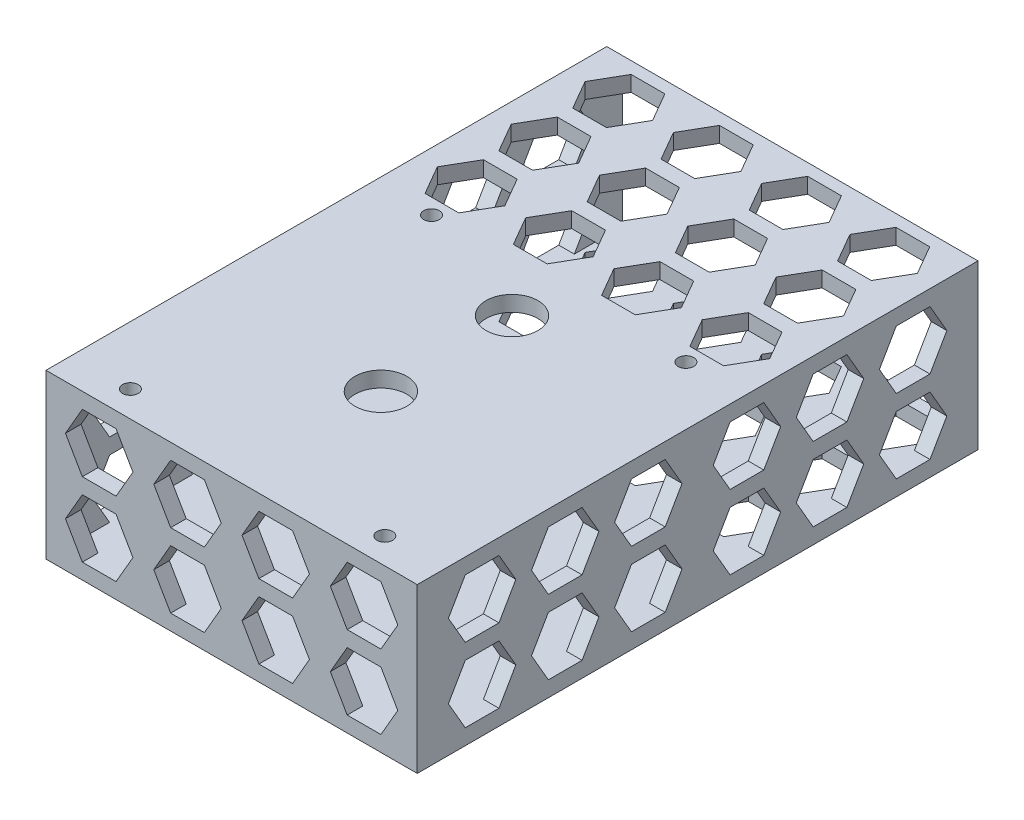
from build123d import *
from OCP.BRepFilletAPI import BRepFilletAPI_MakeChamfer

# Parameters (mm, degrees)
SKETCH5_W           = 71.5
SKETCH5_H           = 108
BOSS_EXTRUDE4_DEPTH = 31.5
SHELL1_T            = -3
SKETCH7_R           = 1.75
CUT_EXTRUDE1_DEPTH  = 73.016057237
CUT_EXTRUDE2_REACH  = 74.016
SKETCH8_R           = 5
CHAMFER1_SIZE       = 1.5
CHAMFER1_SIZE2      = 1.050311307
CUT_EXTRUDE3_REACH  = 74.016
SKETCH9_R           = 1.5
CUT_EXTRUDE4_REACH  = 120.044
CUT_EXTRUDE5_DEPTH  = 95.976312836
CUT_EXTRUDE6_DEPTH  = 73.016057237


with BuildPart() as part:
    # Sketch5 → Boss-Extrude4 (new body)
    with BuildSketch(Plane(origin=(0, 0, 0), x_dir=(1, 0, 0), z_dir=(0, 1, 0))):
        Rectangle(SKETCH5_W, SKETCH5_H)
    extrude(amount=BOSS_EXTRUDE4_DEPTH)

    # Shell1
    shell1_openings = [part.faces().sort_by_distance(p)[0] for p in [
        (0, 15.75, -54),
    ]]
    offset(amount=SHELL1_T, openings=shell1_openings, kind=Kind.INTERSECTION)

    # Sketch7 → Cut-Extrude1 (cut, through all)
    with BuildSketch(Plane(origin=(0, 31.5, 0), x_dir=(1, 0, 0), z_dir=(0, 1, 0))):
        with Locations(Location((0, 0, 0), (0, 0, 270))):
            Circle(SKETCH7_R)
        with Locations(Location((0, -25.25, 0), (0, 0, 90))):
            Circle(SKETCH7_R)
    extrude(amount=-CUT_EXTRUDE1_DEPTH, mode=Mode.SUBTRACT)

    # Sketch8 → Cut-Extrude2 (cut, up to next)
    with BuildSketch(Plane(origin=(0, 31.5, 0), x_dir=(1, 0, 0), z_dir=(0, 1, 0)), mode=Mode.PRIVATE) as cut_extrude2_sk1:
        with Locations(Location((0, -25.25, 0), (0, 0, 270))):
            Circle(SKETCH8_R)
    cut_extrude2_tool1 = extrude(cut_extrude2_sk1.sketch, amount=-CUT_EXTRUDE2_REACH, mode=Mode.PRIVATE) & part.part
    # Sketch8 → Cut-Extrude2 (cut, up to next)
    with BuildSketch(Plane(origin=(0, 31.5, 0), x_dir=(1, 0, 0), z_dir=(0, 1, 0)), mode=Mode.PRIVATE) as cut_extrude2_sk2:
        with Locations(Location((0, 0, 0), (0, 0, 270))):
            Circle(SKETCH8_R)
    cut_extrude2_tool2 = extrude(cut_extrude2_sk2.sketch, amount=-CUT_EXTRUDE2_REACH, mode=Mode.PRIVATE) & part.part
    add(cut_extrude2_tool1.solids().sort_by_distance((0, 31.5, 25.25))[0], mode=Mode.SUBTRACT)
    add(cut_extrude2_tool2.solids().sort_by_distance((0, 31.5, 0))[0], mode=Mode.SUBTRACT)

    # Chamfer1: one chamfer whose edges measure the first distance from different faces: ONE call of the kernel's chamfer builder (chamfer() names one face for all edges)
    chamfer1_edges_1 = [part.edges().sort_by_distance(p)[0] for p in [
        (0, 3, -1.75),
    ]]
    chamfer1_side_1 = [part.faces().sort_by_distance(p)[0] for p in [
        (0, 1.5, -1.75),
    ]]
    chamfer1_edges_2 = [part.edges().sort_by_distance(p)[0] for p in [
        (0, 3, 27),
    ]]
    chamfer1_side_2 = [part.faces().sort_by_distance(p)[0] for p in [
        (0, 1.5, 27),
    ]]
    chamfer1 = BRepFilletAPI_MakeChamfer(part.part.solid().wrapped)
    for e in chamfer1_edges_1:
        chamfer1.Add(CHAMFER1_SIZE, CHAMFER1_SIZE2, e.wrapped, chamfer1_side_1[0].wrapped)  # the first distance lies on this face
    for e in chamfer1_edges_2:
        chamfer1.Add(CHAMFER1_SIZE, CHAMFER1_SIZE2, e.wrapped, chamfer1_side_2[0].wrapped)  # the first distance lies on this face
    add(Compound.cast(chamfer1.Shape()), mode=Mode.REPLACE)

    # Sketch9 → Cut-Extrude3 (cut, up to next)
    with BuildSketch(Plane(origin=(0, 31.5, 0), x_dir=(1, 0, 0), z_dir=(0, 1, 0)), mode=Mode.PRIVATE) as cut_extrude3_sk1:
        with Locations(Location((-24.5, -49, 0), (0, 0, 270))):
            Circle(SKETCH9_R)
    cut_extrude3_tool1 = extrude(cut_extrude3_sk1.sketch, amount=-CUT_EXTRUDE3_REACH, mode=Mode.PRIVATE) & part.part
    # Sketch9 → Cut-Extrude3 (cut, up to next)
    with BuildSketch(Plane(origin=(0, 31.5, 0), x_dir=(1, 0, 0), z_dir=(0, 1, 0)), mode=Mode.PRIVATE) as cut_extrude3_sk2:
        with Locations(Location((24.5, -49, 0), (0, 0, 90))):
            Circle(SKETCH9_R)
    cut_extrude3_tool2 = extrude(cut_extrude3_sk2.sketch, amount=-CUT_EXTRUDE3_REACH, mode=Mode.PRIVATE) & part.part
    # Sketch9 → Cut-Extrude3 (cut, up to next)
    with BuildSketch(Plane(origin=(0, 31.5, 0), x_dir=(1, 0, 0), z_dir=(0, 1, 0)), mode=Mode.PRIVATE) as cut_extrude3_sk3:
        with Locations(Location((-24.5, 9, 0), (0, 0, 270))):
            Circle(SKETCH9_R)
    cut_extrude3_tool3 = extrude(cut_extrude3_sk3.sketch, amount=-CUT_EXTRUDE3_REACH, mode=Mode.PRIVATE) & part.part
    # Sketch9 → Cut-Extrude3 (cut, up to next)
    with BuildSketch(Plane(origin=(0, 31.5, 0), x_dir=(1, 0, 0), z_dir=(0, 1, 0)), mode=Mode.PRIVATE) as cut_extrude3_sk4:
        with Locations(Location((24.5, 9, 0), (0, 0, 90))):
            Circle(SKETCH9_R)
    cut_extrude3_tool4 = extrude(cut_extrude3_sk4.sketch, amount=-CUT_EXTRUDE3_REACH, mode=Mode.PRIVATE) & part.part
    add(cut_extrude3_tool1.solids().sort_by_distance((-24.5, 31.5, 49))[0], mode=Mode.SUBTRACT)
    add(cut_extrude3_tool2.solids().sort_by_distance((24.5, 31.5, 49))[0], mode=Mode.SUBTRACT)
    add(cut_extrude3_tool3.solids().sort_by_distance((-24.5, 31.5, -9))[0], mode=Mode.SUBTRACT)
    add(cut_extrude3_tool4.solids().sort_by_distance((24.5, 31.5, -9))[0], mode=Mode.SUBTRACT)

    # Sketch10 → Cut-Extrude4 (cut, up to next)
    with BuildSketch(Plane.XY.offset(54), mode=Mode.PRIVATE) as cut_extrude4_sk1:
        Polygon((-32, 22.875), (-28.752404736, 17.25), (-22.257214207, 17.25), (-19.009618943, 22.875), (-22.257214207, 28.5), (-28.752404736, 28.5), align=None)
    cut_extrude4_tool1 = extrude(cut_extrude4_sk1.sketch, amount=-CUT_EXTRUDE4_REACH, mode=Mode.PRIVATE) & part.part
    # Sketch10 → Cut-Extrude4 (cut, up to next)
    with BuildSketch(Plane.XY.offset(54), mode=Mode.PRIVATE) as cut_extrude4_sk2:
        Polygon((-28.752404736, 3), (-32, 8.625), (-28.752404736, 14.25), (-22.257214207, 14.25), (-19.009618943, 8.625), (-22.257214207, 3), align=None)
    cut_extrude4_tool2 = extrude(cut_extrude4_sk2.sketch, amount=-CUT_EXTRUDE4_REACH, mode=Mode.PRIVATE) & part.part
    # Sketch10 → Cut-Extrude4 (cut, up to next)
    with BuildSketch(Plane.XY.offset(54), mode=Mode.PRIVATE) as cut_extrude4_sk3:
        Polygon((-11.742785793, 3), (-5.247595264, 3), (-2, 8.625), (-5.247595264, 14.25), (-11.742785793, 14.25), (-14.990381057, 8.625), align=None)
    cut_extrude4_tool3 = extrude(cut_extrude4_sk3.sketch, amount=-CUT_EXTRUDE4_REACH, mode=Mode.PRIVATE) & part.part
    # Sketch10 → Cut-Extrude4 (cut, up to next)
    with BuildSketch(Plane.XY.offset(54), mode=Mode.PRIVATE) as cut_extrude4_sk4:
        Polygon((-5.247595264, 28.5), (-2, 22.875), (-5.247595264, 17.25), (-11.742785793, 17.25), (-14.990381057, 22.875), (-11.742785793, 28.5), align=None)
    cut_extrude4_tool4 = extrude(cut_extrude4_sk4.sketch, amount=-CUT_EXTRUDE4_REACH, mode=Mode.PRIVATE) & part.part
    # Sketch10 → Cut-Extrude4 (cut, up to next)
    with BuildSketch(Plane.XY.offset(54), mode=Mode.PRIVATE) as cut_extrude4_sk5:
        Polygon((22.257214207, 3), (28.752404736, 3), (32, 8.625), (28.752404736, 14.25), (22.257214207, 14.25), (19.009618943, 8.625), align=None)
    cut_extrude4_tool5 = extrude(cut_extrude4_sk5.sketch, amount=-CUT_EXTRUDE4_REACH, mode=Mode.PRIVATE) & part.part
    # Sketch10 → Cut-Extrude4 (cut, up to next)
    with BuildSketch(Plane.XY.offset(54), mode=Mode.PRIVATE) as cut_extrude4_sk6:
        Polygon((14.990381057, 8.625), (11.742785793, 3), (5.247595264, 3), (2, 8.625), (5.247595264, 14.25), (11.742785793, 14.25), align=None)
    cut_extrude4_tool6 = extrude(cut_extrude4_sk6.sketch, amount=-CUT_EXTRUDE4_REACH, mode=Mode.PRIVATE) & part.part
    # Sketch10 → Cut-Extrude4 (cut, up to next)
    with BuildSketch(Plane.XY.offset(54), mode=Mode.PRIVATE) as cut_extrude4_sk7:
        Polygon((11.742785793, 28.5), (5.247595264, 28.5), (2, 22.875), (5.247595264, 17.25), (11.742785793, 17.25), (14.990381057, 22.875), align=None)
    cut_extrude4_tool7 = extrude(cut_extrude4_sk7.sketch, amount=-CUT_EXTRUDE4_REACH, mode=Mode.PRIVATE) & part.part
    # Sketch10 → Cut-Extrude4 (cut, up to next)
    with BuildSketch(Plane.XY.offset(54), mode=Mode.PRIVATE) as cut_extrude4_sk8:
        Polygon((28.752404736, 28.5), (32, 22.875), (28.752404736, 17.25), (22.257214207, 17.25), (19.009618943, 22.875), (22.257214207, 28.5), align=None)
    cut_extrude4_tool8 = extrude(cut_extrude4_sk8.sketch, amount=-CUT_EXTRUDE4_REACH, mode=Mode.PRIVATE) & part.part
    add(cut_extrude4_tool1.solids().sort_by_distance((-25.504809, 22.875, 54))[0], mode=Mode.SUBTRACT)
    add(cut_extrude4_tool2.solids().sort_by_distance((-25.504809, 8.625, 54))[0], mode=Mode.SUBTRACT)
    add(cut_extrude4_tool3.solids().sort_by_distance((-8.495191, 8.625, 54))[0], mode=Mode.SUBTRACT)
    add(cut_extrude4_tool4.solids().sort_by_distance((-8.495191, 22.875, 54))[0], mode=Mode.SUBTRACT)
    add(cut_extrude4_tool5.solids().sort_by_distance((25.504809, 8.625, 54))[0], mode=Mode.SUBTRACT)
    add(cut_extrude4_tool6.solids().sort_by_distance((8.495191, 8.625, 54))[0], mode=Mode.SUBTRACT)
    add(cut_extrude4_tool7.solids().sort_by_distance((8.495191, 22.875, 54))[0], mode=Mode.SUBTRACT)
    add(cut_extrude4_tool8.solids().sort_by_distance((25.504809, 22.875, 54))[0], mode=Mode.SUBTRACT)

    # Sketch12 → Cut-Extrude5 (cut, through all)
    with BuildSketch(Plane.ZY.offset(35.75)):
        Polygon((48, 22.875), (44.752404736, 28.5), (38.257214207, 28.5), (35.009618943, 22.875), (38.257214207, 17.25), (44.752404736, 17.25), align=None)
        Polygon((6.247595264, 17.25), (3, 22.875), (6.247595264, 28.5), (12.742785793, 28.5), (15.990381057, 22.875), (12.742785793, 17.25), align=None)
        Polygon((31.995190528, 22.875), (28.747595264, 28.5), (22.252404736, 28.5), (19.004809472, 22.875), (22.252404736, 17.25), (28.747595264, 17.25), align=None)
        Polygon((44.752404736, 14.25), (48, 8.625), (44.752404736, 3), (38.257214207, 3), (35.009618943, 8.625), (38.257214207, 14.25), align=None)
        Polygon((28.747595264, 14.25), (31.995190528, 8.625), (28.747595264, 3), (22.252404736, 3), (19.004809472, 8.625), (22.252404736, 14.25), align=None)
        Polygon((12.742785793, 14.25), (6.247595264, 14.25), (3, 8.625), (6.247595264, 3), (12.742785793, 3), (15.990381057, 8.625), align=None)
        Polygon((-15.990381057, 8.625), (-12.742785793, 14.25), (-6.247595264, 14.25), (-3, 8.625), (-6.247595264, 3), (-12.742785793, 3), align=None)
        Polygon((-22.252404736, 14.25), (-28.747595264, 14.25), (-31.995190528, 8.625), (-28.747595264, 3), (-22.252404736, 3), (-19.004809472, 8.625), align=None)
        Polygon((-38.257214207, 14.25), (-44.752404736, 14.25), (-48, 8.625), (-44.752404736, 3), (-38.257214207, 3), (-35.009618943, 8.625), align=None)
        Polygon((-44.752404736, 17.25), (-48, 22.875), (-44.752404736, 28.5), (-38.257214207, 28.5), (-35.009618943, 22.875), (-38.257214207, 17.25), align=None)
        Polygon((-28.747595264, 17.25), (-31.995190528, 22.875), (-28.747595264, 28.5), (-22.252404736, 28.5), (-19.004809472, 22.875), (-22.252404736, 17.25), align=None)
        Polygon((-12.742785793, 17.25), (-6.247595264, 17.25), (-3, 22.875), (-6.247595264, 28.5), (-12.742785793, 28.5), (-15.990381057, 22.875), align=None)
    extrude(amount=-CUT_EXTRUDE5_DEPTH, mode=Mode.SUBTRACT)

    # Sketch13 → Cut-Extrude6 (cut, through all)
    with BuildSketch(Plane(origin=(0, 31.5, 0), x_dir=(1, 0, 0), z_dir=(0, 1, 0))):
        Polygon((-22.257214207, 51.7), (-19.009618943, 46.075), (-22.257214207, 40.45), (-28.752404736, 40.45), (-32, 46.075), (-28.752404736, 51.7), align=None)
        Polygon((-19.009618943, 31.85), (-22.257214207, 37.475), (-28.752404736, 37.475), (-32, 31.85), (-28.752404736, 26.225), (-22.257214207, 26.225), align=None)
        Polygon((-19.009618943, 17.625), (-22.257214207, 23.25), (-28.752404736, 23.25), (-32, 17.625), (-28.752404736, 12), (-22.257214207, 12), align=None)
        Polygon((-5.247595264, 51.7), (-11.742785793, 51.7), (-14.990381057, 46.075), (-11.742785793, 40.45), (-5.247595264, 40.45), (-2, 46.075), align=None)
        Polygon((-11.742785793, 26.225), (-14.990381057, 31.85), (-11.742785793, 37.475), (-5.247595264, 37.475), (-2, 31.85), (-5.247595264, 26.225), align=None)
        Polygon((-11.742785793, 12), (-14.990381057, 17.625), (-11.742785793, 23.25), (-5.247595264, 23.25), (-2, 17.625), (-5.247595264, 12), align=None)
        Polygon((5.247595264, 12), (11.742785793, 12), (14.990381057, 17.625), (11.742785793, 23.25), (5.247595264, 23.25), (2, 17.625), align=None)
        Polygon((22.257214207, 12), (19.009618943, 17.625), (22.257214207, 23.25), (28.752404736, 23.25), (32, 17.625), (28.752404736, 12), align=None)
        Polygon((5.247595264, 26.225), (11.742785793, 26.225), (14.990381057, 31.85), (11.742785793, 37.475), (5.247595264, 37.475), (2, 31.85), align=None)
        Polygon((22.257214207, 26.225), (19.009618943, 31.85), (22.257214207, 37.475), (28.752404736, 37.475), (32, 31.85), (28.752404736, 26.225), align=None)
        Polygon((2, 46.075), (5.247595264, 51.7), (11.742785793, 51.7), (14.990381057, 46.075), (11.742785793, 40.45), (5.247595264, 40.45), align=None)
        Polygon((28.752404736, 51.7), (22.257214207, 51.7), (19.009618943, 46.075), (22.257214207, 40.45), (28.752404736, 40.45), (32, 46.075), align=None)
    extrude(amount=-CUT_EXTRUDE6_DEPTH, mode=Mode.SUBTRACT)


solid = part.part
